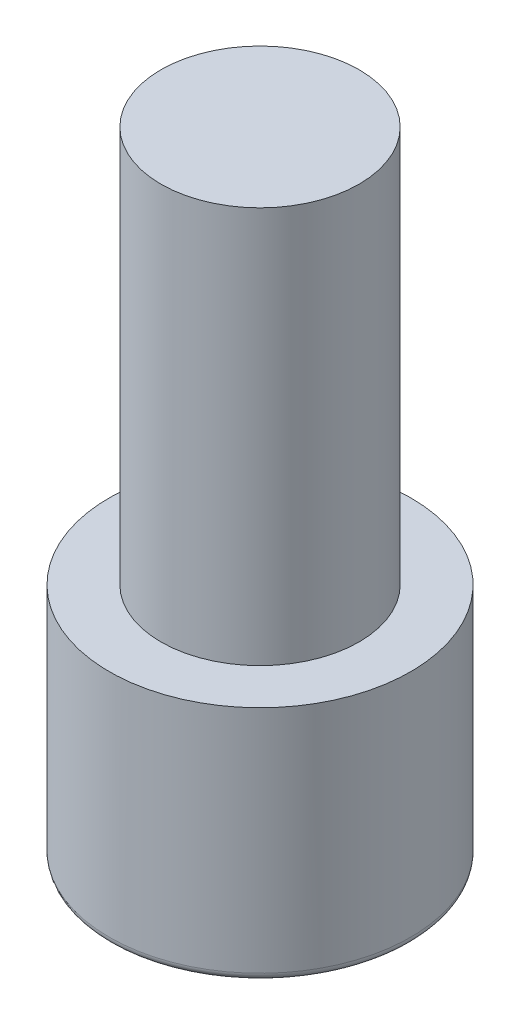
from build123d import *

# Parameters (mm, degrees)
SKETCH1_R           = 4.826
BOSS_EXTRUDE1_DEPTH = 7.62
SKETCH2_R           = 3.175
BOSS_EXTRUDE2_DEPTH = 12.7
FILLET1_R           = 0.254


with BuildPart() as part:
    # Sketch1 → Boss-Extrude1 (new body)
    with BuildSketch(Plane(origin=(0, 0, 0), x_dir=(1, 0, 0), z_dir=(0, 1, 0))):
        with Locations(Location((0, 0, 0), (0, 0, 90))):
            Circle(SKETCH1_R)
    extrude(amount=BOSS_EXTRUDE1_DEPTH)

    # Sketch2 → Boss-Extrude2 (add)
    with BuildSketch(Plane(origin=(0, 7.62, 0), x_dir=(1, 0, 0), z_dir=(0, 1, 0))):
        with Locations(Location((0, 0, 0), (0, 0, 270))):
            Circle(SKETCH2_R)
    extrude(amount=BOSS_EXTRUDE2_DEPTH)

    # Fillet1
    fillet1_edges = [part.edges().sort_by_distance(p)[0] for p in [
        (0, 0, 4.826),
    ]]
    fillet(fillet1_edges, radius=FILLET1_R)


solid = part.part
